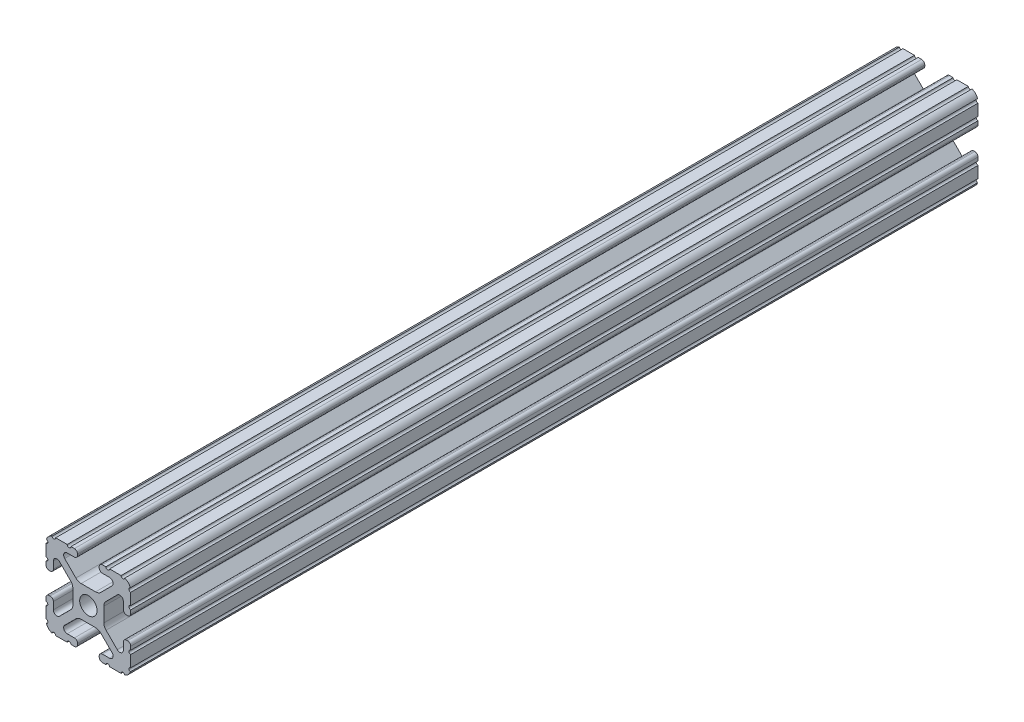
from build123d import *

# Parameters (mm, degrees)
BOSS_EXTRUDE1_DEPTH     = 152.4
CUT_EXTRUDE1_DEPTH      = 154.454683865
CUT_EXTRUDE1_DEPTH_BACK = 154.454683865
SKETCH5_R               = 0.55245
SKETCH6_R               = 2.6035
CUT_EXTRUDE2_DEPTH      = 38.1
CUT_EXTRUDE3_DEPTH      = 61.468
CUT_EXTRUDE3_DEPTH_BACK = 61.468
SKETCH7_W               = 50.8
SKETCH7_H               = 50.856579656


with BuildPart() as part:
    # Sketch4 → Boss-Extrude1 (new, symmetric)
    with BuildSketch(Plane.XY):
        with BuildLine():
            Line((4.190365, -12.7), (10.11729625, -12.7))
            ThreePointArc((10.11729625, -12.7), (11.943543585, -11.943543585), (12.7, -10.11729625))
            Line((12.7, -10.11729625), (12.7, -4.190365))
            ThreePointArc((12.7, -4.190365), (12.42492494, -3.52627506), (11.760835, -3.2512))
            Line((11.760835, -3.2512), (11.429365, -3.2512))
            ThreePointArc((11.429365, -3.2512), (10.76527506, -3.52627506), (10.4902, -4.190365))
            Line((10.4902, -4.190365), (10.4902, -6.348478019))
            ThreePointArc((10.4902, -6.348478019), (9.830707141, -7.335478831), (8.666460301, -7.103895736))
            Line((8.666460301, -7.103895736), (5.299899128, -3.737334563))
            ThreePointArc((5.299899128, -3.737334563), (4.817571085, -3.015479634), (4.6482, -2.16399369))
            Line((4.6482, -2.16399369), (4.6482, 0))
            Line((4.6482, 0), (2.6035, 0))
            ThreePointArc((2.6035, 0), (1.840952505, -1.840952505), (0, -2.6035))
            Line((0, -2.6035), (0, -4.6482))
            Line((0, -4.6482), (2.16399369, -4.6482))
            ThreePointArc((2.16399369, -4.6482), (3.015479634, -4.817571085), (3.737334563, -5.299899128))
            Line((3.737334563, -5.299899128), (7.103895736, -8.666460301))
            ThreePointArc((7.103895736, -8.666460301), (7.335478831, -9.830707141), (6.348478019, -10.4902))
            Line((6.348478019, -10.4902), (4.190365, -10.4902))
            ThreePointArc((4.190365, -10.4902), (3.52627506, -10.76527506), (3.2512, -11.429365))
            Line((3.2512, -11.429365), (3.2512, -11.760835))
            ThreePointArc((3.2512, -11.760835), (3.52627506, -12.42492494), (4.190365, -12.7))
        make_face()
    extrude(amount=BOSS_EXTRUDE1_DEPTH, both=True)

    # Sketch5 → Cut-Extrude1 (cut, two sides: drawn at the far end of the back side and taken through both)
    with BuildSketch(Plane.XY.offset(-CUT_EXTRUDE1_DEPTH_BACK)):
        with Locations((10.356153152, -12.7)):
            Circle(SKETCH5_R)
        with Locations((5.796028019, -12.7)):
            Circle(SKETCH5_R)
        with Locations((12.7, -10.356153152)):
            Circle(SKETCH5_R)
        with Locations((12.7, -5.796028019)):
            Circle(SKETCH5_R)
    extrude(amount=CUT_EXTRUDE1_DEPTH + CUT_EXTRUDE1_DEPTH_BACK, mode=Mode.SUBTRACT)

    # Mirror1: part across plane


with BuildPart() as part_1:
    add(part.part)
    add(part.part.mirror(Plane(origin=(0, 0, 0), x_dir=(0, 0, 1), z_dir=(1, 0, 0))))

    # Mirror2: part across plane


with BuildPart() as part_2:
    add(part_1.part)
    add(part_1.part.mirror(Plane.ZX))

    # Sketch6 → Cut-Extrude2 (cut)
    with BuildSketch(Plane.ZY.offset(4.6482)):
        with Locations((-139.7, 0)):
            Circle(SKETCH6_R)
        with Locations((-63.5, 0)):
            Circle(SKETCH6_R)
    extrude(amount=-CUT_EXTRUDE2_DEPTH, mode=Mode.SUBTRACT)

    # Sketch7 → Cut-Extrude3 (cut, two sides: drawn at the far end of the back side and taken through both)
    with BuildSketch(Plane.ZY.offset(12.7).offset(-CUT_EXTRUDE3_DEPTH_BACK)):
        with Locations((127, 7.705714012)):
            Rectangle(SKETCH7_W, SKETCH7_H)
    extrude(amount=CUT_EXTRUDE3_DEPTH + CUT_EXTRUDE3_DEPTH_BACK, mode=Mode.SUBTRACT)


solid = part_2.part
